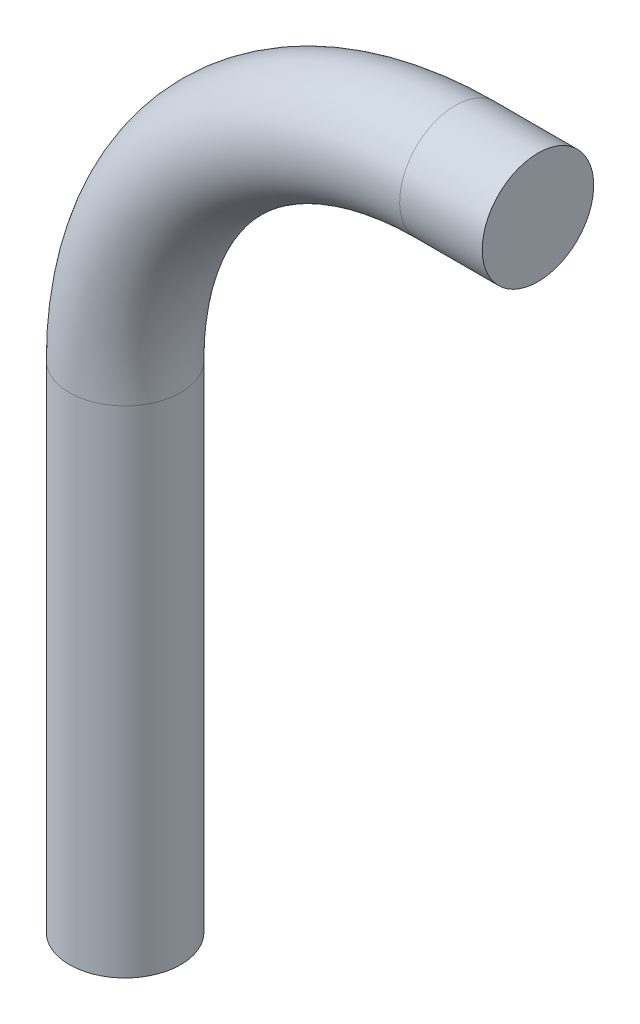
from build123d import *

# Parameters (mm, degrees)
SKETCH2_R = 6.75


with BuildPart() as part:
    # Sweep1: sweep along a path in Sketch1
    with BuildLine(Plane.XY) as sweep1_path:
        Line((0, 0), (0, 60))
        ThreePointArc((0, 60), (11.715728753, 88.284271247), (40, 100))
        Line((40, 100), (50, 100))
    # Sketch2 → Sweep1 (sweep)
    with BuildSketch(Plane(origin=(0, 0, 0), x_dir=(1, 0, 0), z_dir=(0, 1, 0))):
        Circle(SKETCH2_R)
    sweep(path=sweep1_path.line)


solid = part.part
